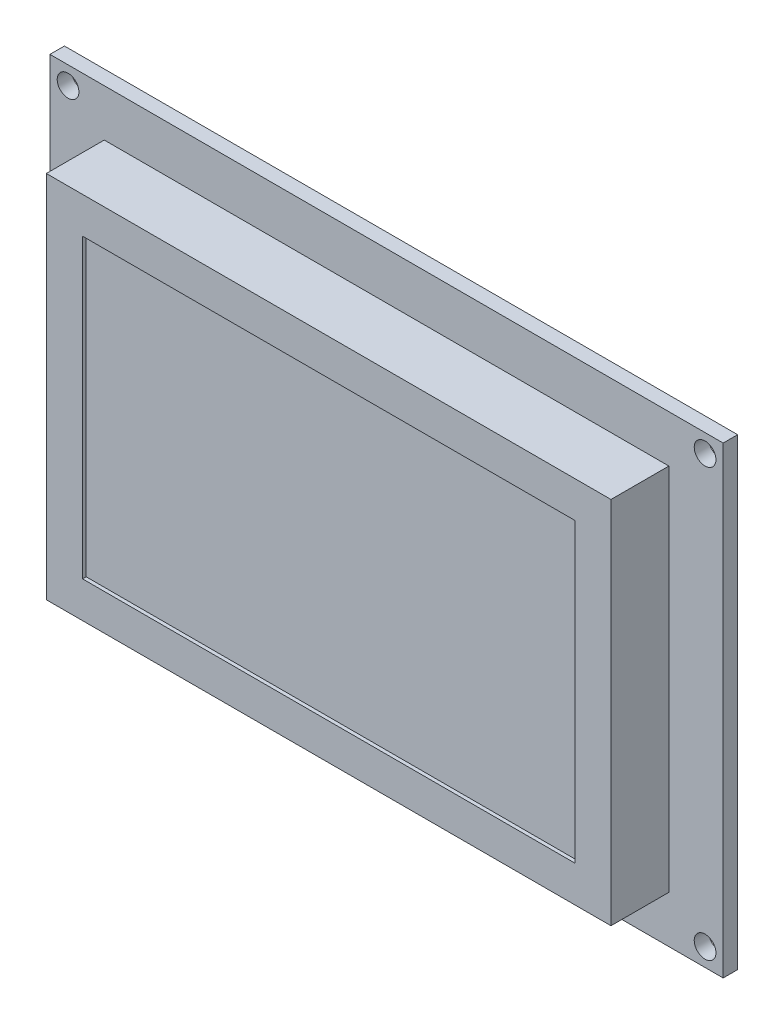
from build123d import *

# Parameters (mm, degrees)
SKETCH_1_W          = 93
SKETCH_1_H          = 64
EXTRUDE_1_DEPTH     = 2
SKETCH_3_W          = 78
SKETCH_3_H          = 51
EXTRUDE_2_DEPTH     = 8
SKETCH_4_R          = 1.5
CUT_EXTRUDE_1_DEPTH = 114.176852757
SKETCH_5_W          = 68
SKETCH_5_H          = 41
CUT_EXTRUDE_2_DEPTH = 0.5
SKETCH_6_R          = 0.5
EXTRUDE_3_DEPTH     = 10


with BuildPart() as part:
    # 草图1 → 凸台-拉伸1 (new body)
    with BuildSketch(Plane.XY):
        with Locations((46.5, 32)):
            Rectangle(SKETCH_1_W, SKETCH_1_H)
    extrude(amount=EXTRUDE_1_DEPTH)

    # 草图3 → 凸台-拉伸2 (add)
    with BuildSketch(Plane.XY.offset(2)):
        with Locations((46.5, 32)):
            Rectangle(SKETCH_3_W, SKETCH_3_H)
    extrude(amount=EXTRUDE_2_DEPTH)

    # 草图4 → 切除-拉伸1 (cut, through all)
    with BuildSketch(Plane.XY.offset(2)):
        with Locations((2.5, 61.5)):
            Circle(SKETCH_4_R)
        with Locations(Location((90.5, 61.5, 0), (0, 0, 180))):
            Circle(SKETCH_4_R)
        with Locations((90.5, 2.5)):
            Circle(SKETCH_4_R)
        with Locations(Location((2.5, 2.5, 0), (0, 0, 180))):
            Circle(SKETCH_4_R)
    extrude(amount=-CUT_EXTRUDE_1_DEPTH, mode=Mode.SUBTRACT)

    # 草图5 → 切除-拉伸2 (cut)
    with BuildSketch(Plane.XY.offset(10)):
        with Locations((46.5, 32)):
            Rectangle(SKETCH_5_W, SKETCH_5_H)
    extrude(amount=-CUT_EXTRUDE_2_DEPTH, mode=Mode.SUBTRACT)

    # 草图6 → 凸台-拉伸3 (add)
    with BuildSketch(Plane.XY.offset(2)):
        with Locations((14, 2)):
            Circle(SKETCH_6_R)
        with Locations((16.54, 2)):
            Circle(SKETCH_6_R)
        with Locations((19.08, 2)):
            Circle(SKETCH_6_R)
        with Locations((21.62, 2)):
            Circle(SKETCH_6_R)
        with Locations((24.16, 2)):
            Circle(SKETCH_6_R)
        with Locations((26.7, 2)):
            Circle(SKETCH_6_R)
        with Locations((29.24, 2)):
            Circle(SKETCH_6_R)
        with Locations((31.78, 2)):
            Circle(SKETCH_6_R)
        with Locations((34.32, 2)):
            Circle(SKETCH_6_R)
        with Locations((36.86, 2)):
            Circle(SKETCH_6_R)
        with Locations((39.4, 2)):
            Circle(SKETCH_6_R)
        with Locations((41.94, 2)):
            Circle(SKETCH_6_R)
        with Locations((44.48, 2)):
            Circle(SKETCH_6_R)
        with Locations((47.02, 2)):
            Circle(SKETCH_6_R)
        with Locations((49.56, 2)):
            Circle(SKETCH_6_R)
        with Locations((52.1, 2)):
            Circle(SKETCH_6_R)
        with Locations((54.64, 2)):
            Circle(SKETCH_6_R)
        with Locations((57.18, 2)):
            Circle(SKETCH_6_R)
        with Locations((59.72, 2)):
            Circle(SKETCH_6_R)
        with Locations((62.26, 2)):
            Circle(SKETCH_6_R)
    extrude(amount=-EXTRUDE_3_DEPTH)


solid = part.part
